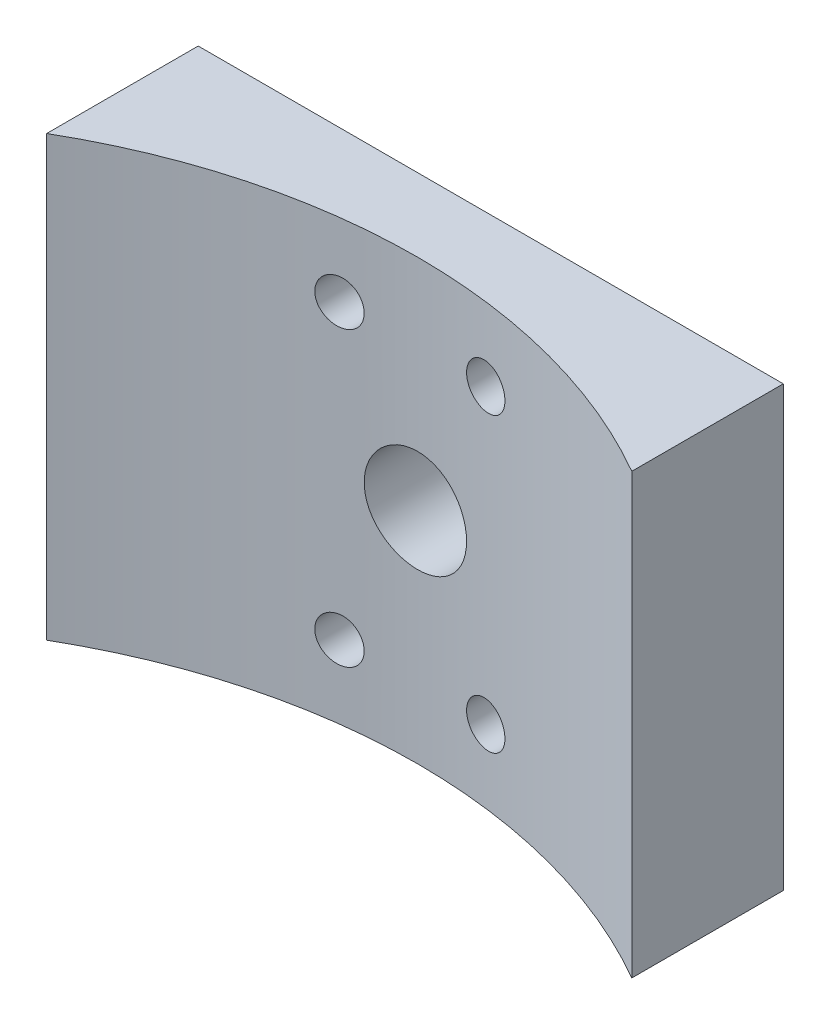
from build123d import *

# Parameters (mm, degrees)
Y_KSEKLIK_EKSTR_ZYON1_DEPTH = 30
IZIM2_R                     = 1.5
IZIM2_R_2                   = 3.5
KES_EKSTR_ZYON1_DEPTH       = 58.662812973


with BuildPart() as part:
    # Çizim1 → Yükseklik-Ekstrüzyon1 (new body)
    with BuildSketch(Plane(origin=(0, 0, 0), x_dir=(1, 0, 0), z_dir=(0, 1, 0))):
        with BuildLine():
            Line((20, 40), (20, 34.641016151))
            ThreePointArc((20, 34.641016151), (0, 40), (-20, 34.641016151))
            Line((-20, 34.641016151), (-20, 45))
            Line((-20, 45), (20, 45))
            Line((20, 45), (20, 40))
        make_face()
    extrude(amount=Y_KSEKLIK_EKSTR_ZYON1_DEPTH)

    # Çizim2 → Kes-Ekstrüzyon1 (cut, through all)
    with BuildSketch(Plane.XY):
        with Locations((-5, 5)):
            Circle(IZIM2_R)
        with Locations((5, 5)):
            Circle(IZIM2_R)
        with Locations((5, 25)):
            Circle(IZIM2_R)
        with Locations((-5, 25)):
            Circle(IZIM2_R)
        with Locations((0, 15)):
            Circle(IZIM2_R_2)
    extrude(amount=-KES_EKSTR_ZYON1_DEPTH, mode=Mode.SUBTRACT)


solid = part.part
